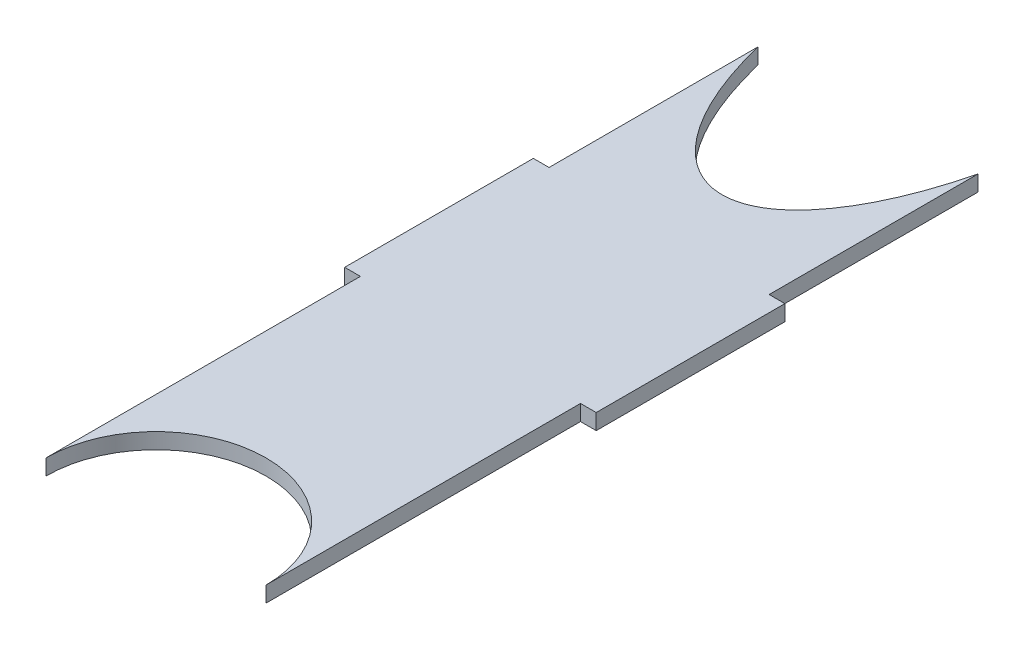
from build123d import *

# Parameters (mm, degrees)
SKETCH1_W           = 1.5875
SKETCH1_H           = 19.05
BOSS_EXTRUDE1_DEPTH = 1.5875


with BuildPart() as part:
    # Sketch1 → Boss-Extrude1 (new body)
    with BuildSketch(Plane(origin=(0, 0, 0), x_dir=(1, 0, 0), z_dir=(0, 1, 0))):
        with BuildLine():
            Line((11.1125, 7.9375), (11.1125, 29.02868761))
            add(Edge.make_bspline(
                [(-11.1125, 29.02868761), (0, -16.161766196), (11.1125, 29.02868761)],
                knots=[2.076156837, 2.076156837, 2.076156837, 4.20702847, 4.20702847, 4.20702847], degree=2, weights=[1, 0.484122918, 1]))
            Line((-11.1125, 29.02868761), (-11.1125, 7.9375))
            Line((-11.1125, 7.9375), (-11.1125, -11.1125))
            Line((-11.1125, -11.1125), (-11.1125, -42.8625))
            ThreePointArc((-11.1125, -42.8625), (0, -31.75), (11.1125, -42.8625))
            Line((11.1125, -42.8625), (11.1125, -11.1125))
            Line((11.1125, -11.1125), (11.1125, 7.9375))
        make_face()
        with Locations((11.90625, -1.5875)):
            Rectangle(SKETCH1_W, SKETCH1_H)
        with Locations((-11.90625, -1.5875)):
            Rectangle(SKETCH1_W, SKETCH1_H)
    extrude(amount=BOSS_EXTRUDE1_DEPTH)


solid = part.part
